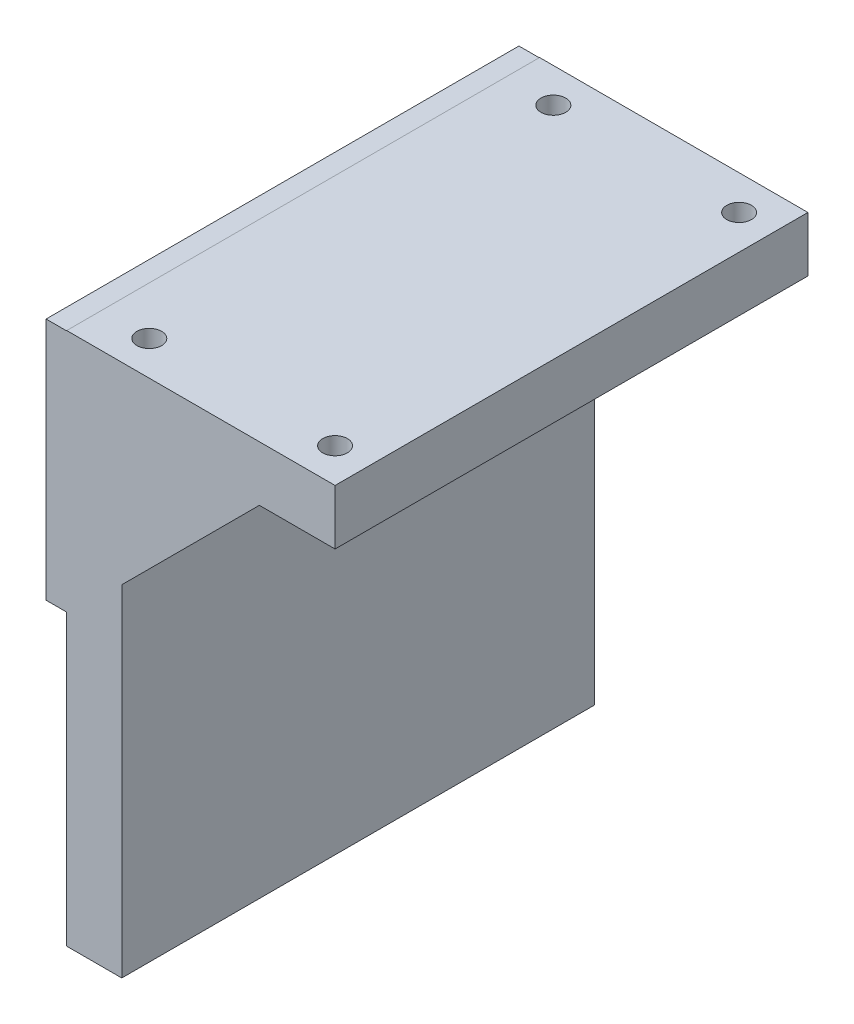
from build123d import *

# Parameters (mm, degrees)
BOSS_EXTRUDE1_DEPTH = 68.724264069
BOSS_EXTRUDE2_DEPTH = 68.724264069
SKETCH2_R           = 1.8
CUT_EXTRUDE1_DEPTH  = 6
SKETCH3_R           = 1.8
CUT_EXTRUDE2_DEPTH  = 6
SKETCH5_W           = 68.724264069
SKETCH5_H           = 35.396446609
BOSS_EXTRUDE3_DEPTH = 3


with BuildPart() as part:
    # Sketch1 → Boss-Extrude1 (new body)
    with BuildSketch(Plane.XY.offset(10)):
        Polygon((24.362132034, 0), (24.362132034, 77.496446609), (63.362132034, 77.496446609), (63.362132034, 69.496446609), (32.362132034, 69.496446609), (32.362132034, 0), align=None)
    extrude(amount=-BOSS_EXTRUDE1_DEPTH)

    # Sketch4 → Boss-Extrude2 (add)
    with BuildSketch(Plane.XY.offset(10)):
        Polygon((32.362132034, 49.496446609), (32.362132034, 69.496446609), (52.362132034, 69.496446609), align=None)
    extrude(amount=-BOSS_EXTRUDE2_DEPTH)

    # Sketch2 → Cut-Extrude1 (cut)
    with BuildSketch(Plane(origin=(0, 77.496446609, 0), x_dir=(1, 0, 0), z_dir=(0, 1, 0))):
        with Locations(Location((58.362132034, 53.724264069, 0), (0, 0, 180))):
            Circle(SKETCH2_R)
        with Locations(Location((31.362132034, 53.724264069, 0), (0, 0, 180))):
            Circle(SKETCH2_R)
        with Locations(Location((58.362132034, -5, 0), (0, 0, 180))):
            Circle(SKETCH2_R)
        with Locations(Location((31.362132034, -5, 0), (0, 0, 180))):
            Circle(SKETCH2_R)
    extrude(amount=-CUT_EXTRUDE1_DEPTH, mode=Mode.SUBTRACT)

    # Sketch3 → Cut-Extrude2 (cut)
    with BuildSketch(Plane.ZY.offset(-24.362132034)):
        with Locations(Location((-53.724264069, 37, 0), (0, 0, 270))):
            Circle(SKETCH3_R)
        with Locations(Location((-53.724264069, 10, 0), (0, 0, 270))):
            Circle(SKETCH3_R)
        with Locations(Location((5, 10, 0), (0, 0, 270))):
            Circle(SKETCH3_R)
        with Locations(Location((5, 37, 0), (0, 0, 270))):
            Circle(SKETCH3_R)
    extrude(amount=-CUT_EXTRUDE2_DEPTH, mode=Mode.SUBTRACT)

    # Sketch5 → Boss-Extrude3 (add)
    with BuildSketch(Plane.ZY.offset(-24.362132034)):
        with Locations((-24.362132035, 59.748223305)):
            Rectangle(SKETCH5_W, SKETCH5_H)
    extrude(amount=BOSS_EXTRUDE3_DEPTH)


solid = part.part
